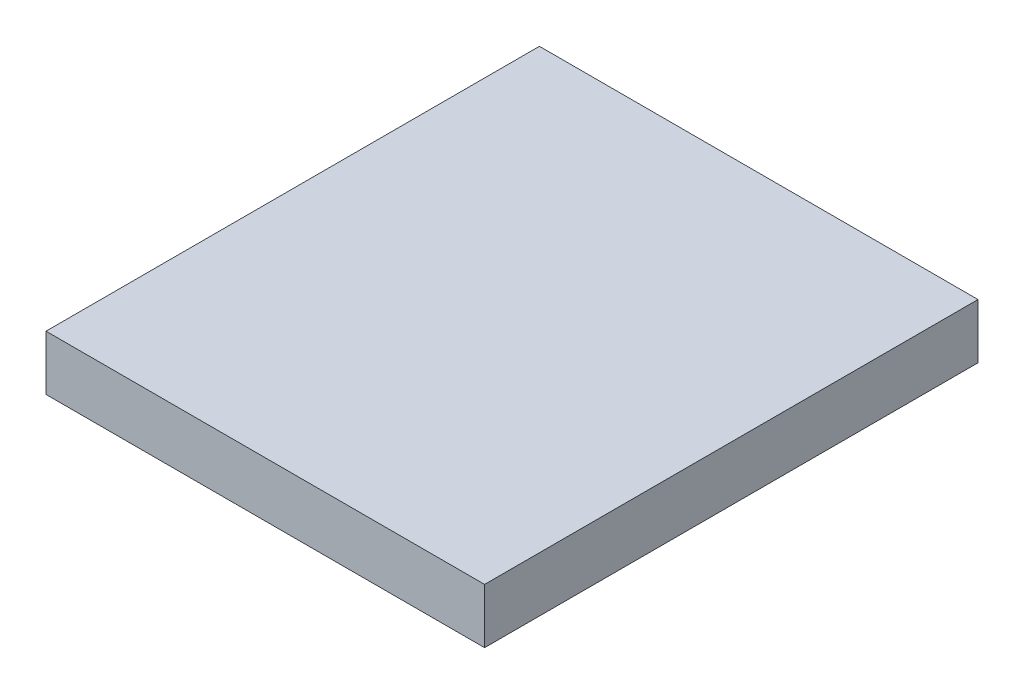
from build123d import *

# Parameters (mm, degrees)
SKETCH_1_W      = 16
SKETCH_1_H      = 18
EXTRUDE_1_DEPTH = 2


with BuildPart() as part:
    # Эскиз1 → Бобышка-Вытянуть1 (new body)
    with BuildSketch(Plane(origin=(0, 0, 0), x_dir=(1, 0, 0), z_dir=(0, 1, 0))):
        Rectangle(SKETCH_1_W, SKETCH_1_H)
    extrude(amount=EXTRUDE_1_DEPTH)


solid = part.part
